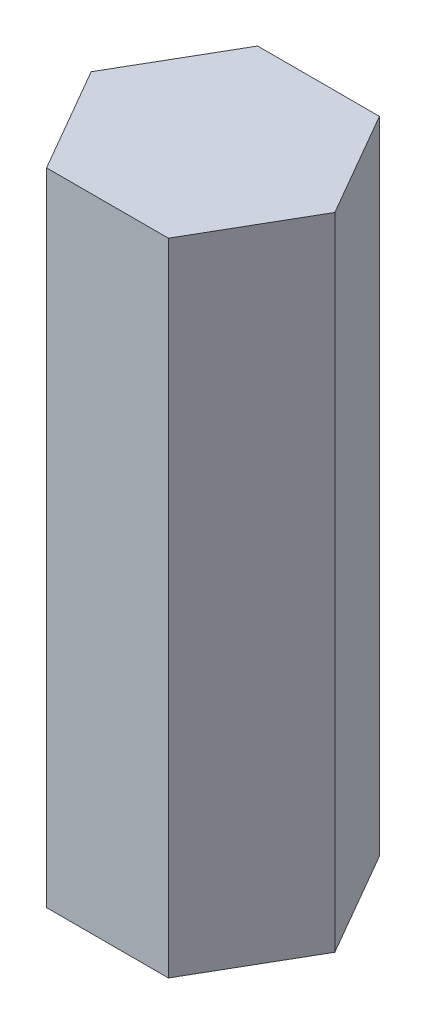
from build123d import *

# Parameters (mm, degrees)
BOSS_EXTRUDE2_DEPTH = 77.1144


with BuildPart() as part:
    # Sketch1 → Boss-Extrude2 (new body)
    with BuildSketch(Plane(origin=(0, 0, 0), x_dir=(1, 0, 0), z_dir=(0, 1, 0))):
        Polygon((14.664696837, 0), (7.332348419, 12.7), (-7.332348419, 12.7), (-14.664696837, 0), (-7.332348419, -12.7), (7.332348419, -12.7), align=None)
    extrude(amount=BOSS_EXTRUDE2_DEPTH)


solid = part.part
